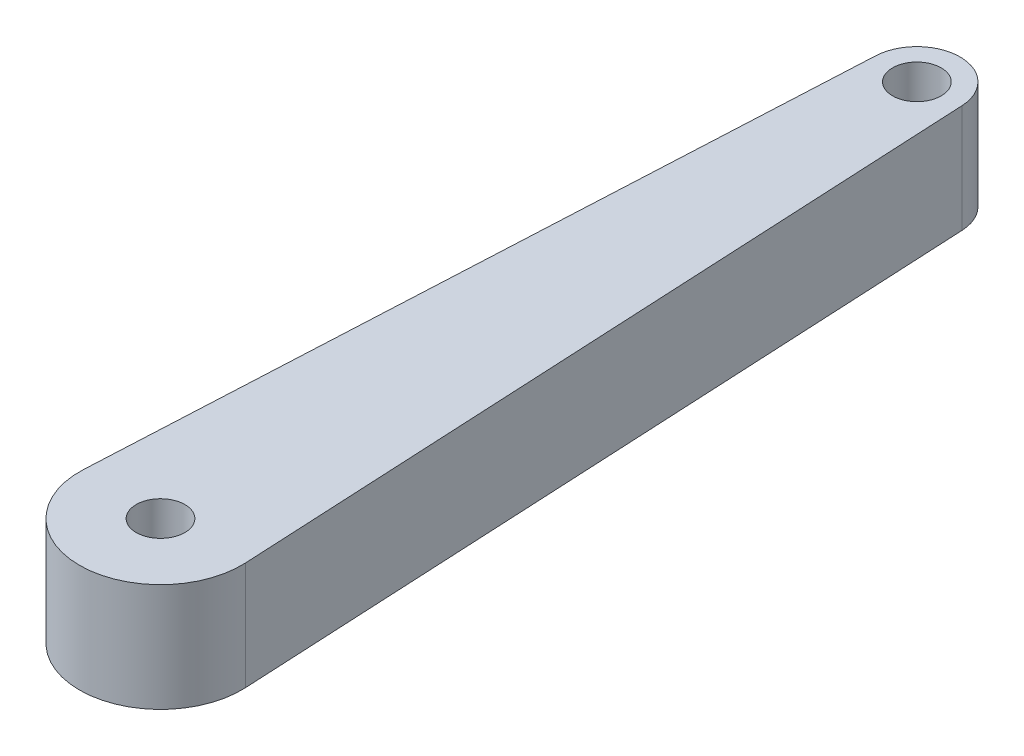
from build123d import *

# Parameters (mm, degrees)
SKETCH1_R           = 1.125
BOSS_EXTRUDE1_DEPTH = 5


with BuildPart() as part:
    # Sketch1 → Boss-Extrude1 (new body)
    with BuildSketch(Plane(origin=(0, 0, 0), x_dir=(1, 0, 0), z_dir=(0, 1, 0))):
        with BuildLine():
            ThreePointArc((-3.745309567, 0.1875), (0, -3.75), (3.745309567, 0.1875))
            Line((3.745309567, 0.1875), (1.997498436, 35.1))
            ThreePointArc((1.997498436, 35.1), (0, 37), (-1.997498436, 35.1))
            Line((-1.997498436, 35.1), (-3.745309567, 0.1875))
        make_face()
        with Locations(Location((0, 0, 0), (0, 0, 270))):
            Circle(SKETCH1_R, mode=Mode.SUBTRACT)
        with Locations(Location((0, 35, 0), (0, 0, 270))):
            Circle(SKETCH1_R, mode=Mode.SUBTRACT)
    extrude(amount=BOSS_EXTRUDE1_DEPTH)


solid = part.part
